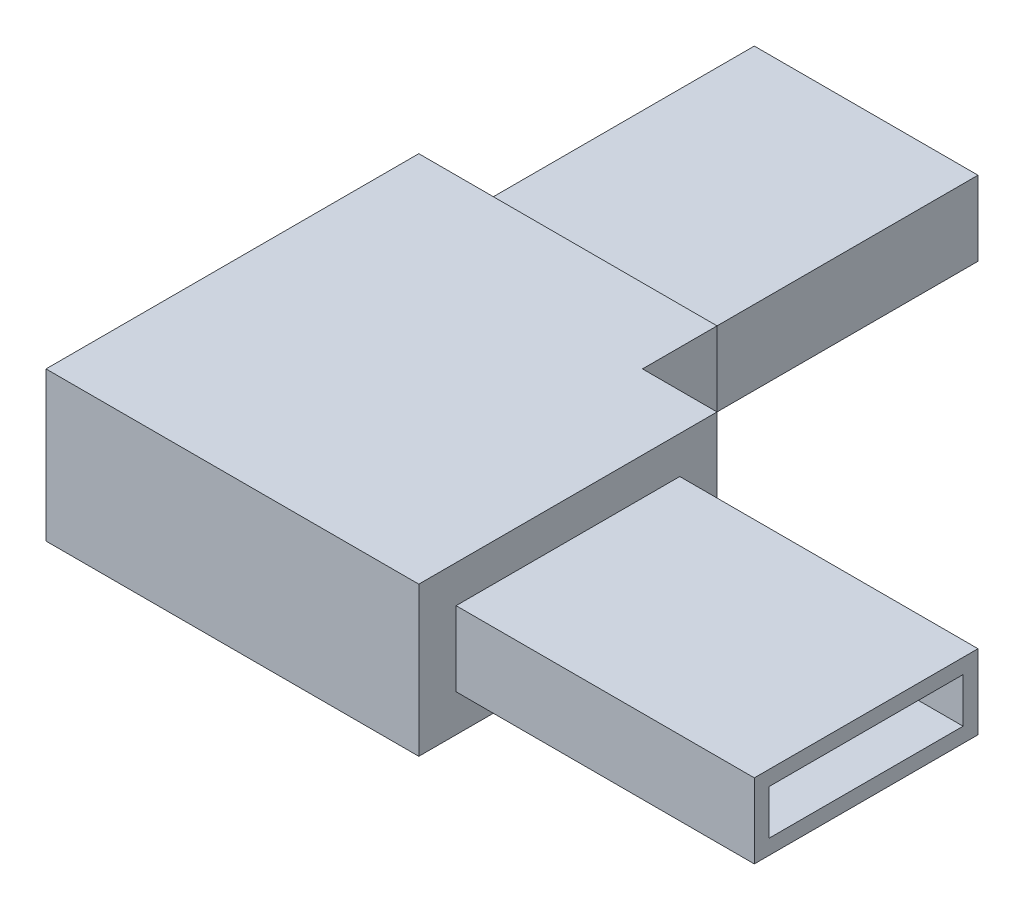
from build123d import *

# Parameters (mm, degrees)
CROQUIS1_W     = 40
CROQUIS1_H     = 50
CROQUIS1_H_2   = 40
CROQUIS1_W_2   = 50
EXTRUIR1_DEPTH = 20
CROQUIS2_W     = 40
CROQUIS2_H     = 20
CROQUIS2_W_2   = 30
CROQUIS2_H_2   = 10
EXTRUIR2_DEPTH = 40
CROQUIS3_W     = 40
CROQUIS3_H     = 20
CROQUIS3_W_2   = 30
CROQUIS3_H_2   = 10
EXTRUIR3_DEPTH = 40
VACIADO1_T     = -2
CROQUIS5_R     = 5
EXTRUIR4_DEPTH = 10


with BuildPart() as part:
    # Croquis1 → Extruir1 (new body)
    with BuildSketch(Plane(origin=(0, 0, 0), x_dir=(1, 0, 0), z_dir=(0, 1, 0))):
        with Locations((0, 45)):
            Rectangle(CROQUIS1_W, CROQUIS1_H)
        Rectangle(CROQUIS1_W, CROQUIS1_H_2)
        with Locations((45, 0)):
            Rectangle(CROQUIS1_W_2, CROQUIS1_H_2)
    extrude(amount=EXTRUIR1_DEPTH)

    # Croquis2 → Extruir2 (cut)
    with BuildSketch(Plane(origin=(70, 0, 0), x_dir=(0, 0, -1), z_dir=(1, 0, 0))):
        with Locations((0, 10)):
            Rectangle(CROQUIS2_W, CROQUIS2_H)
        with Locations((0, 10)):
            Rectangle(CROQUIS2_W_2, CROQUIS2_H_2, mode=Mode.SUBTRACT)
    extrude(amount=-EXTRUIR2_DEPTH, mode=Mode.SUBTRACT)

    # Croquis3 → Extruir3 (cut)
    with BuildSketch(Plane(origin=(0, 0, -70), x_dir=(-1, 0, 0), z_dir=(0, 0, -1))):
        with Locations((0, 10)):
            Rectangle(CROQUIS3_W, CROQUIS3_H)
        with Locations((0, 10)):
            Rectangle(CROQUIS3_W_2, CROQUIS3_H_2, mode=Mode.SUBTRACT)
    extrude(amount=-EXTRUIR3_DEPTH, mode=Mode.SUBTRACT)

    # Vaciado1
    vaciado1_openings = [part.faces().sort_by_distance(p)[0] for p in [
        (70, 10, 0),
        (0, 10, -70),
    ]]
    offset(amount=VACIADO1_T, openings=vaciado1_openings, kind=Kind.INTERSECTION)

    # Croquis5 → Extruir4 (cut)
    with BuildSketch(Plane.ZY.offset(20)):
        with Locations((-5, 10)):
            Circle(CROQUIS5_R)
    extrude(amount=-EXTRUIR4_DEPTH, mode=Mode.SUBTRACT)


solid = part.part
